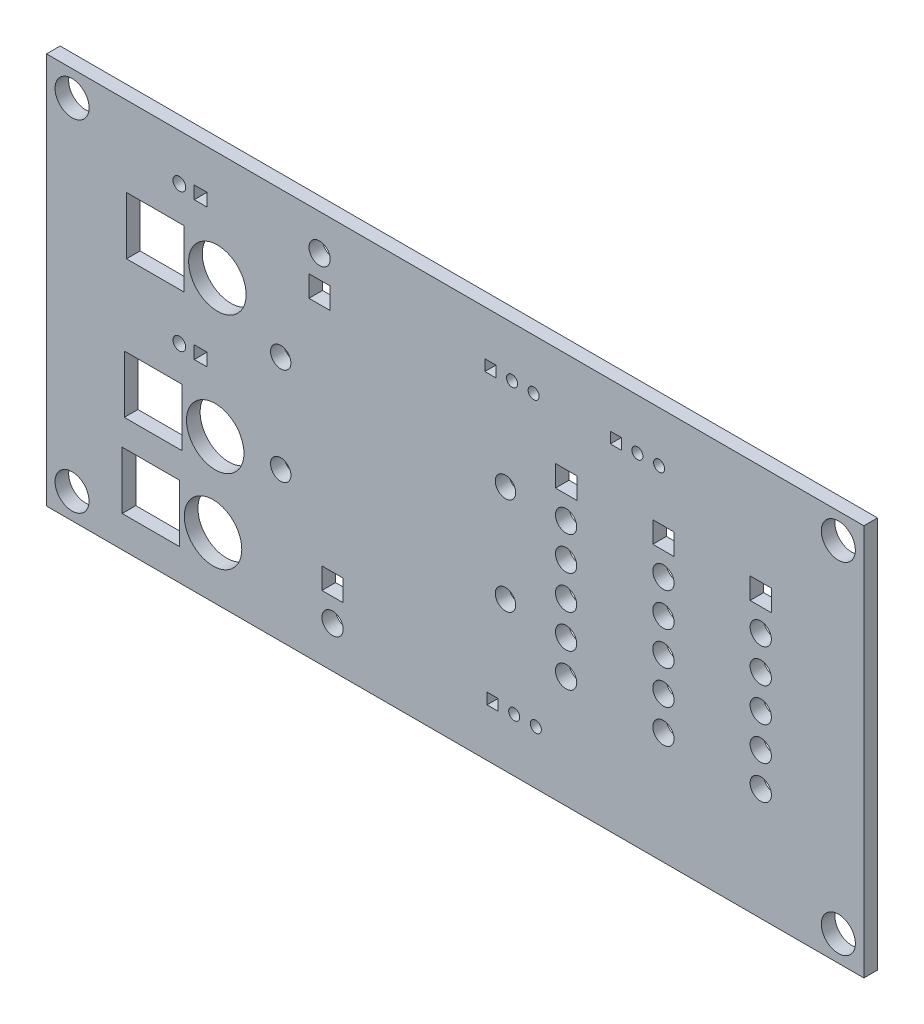
from build123d import *

# Parameters (mm, degrees)
MODEL_W            = 96
MODEL_H            = 46
MODEL_R            = 1.25
MODEL_R_2          = 2
MODEL_R_3          = 0.65
MODEL_R_4          = 1.2
MODEL_R_5          = 0.75
MODEL_R_6          = 3.375
MODEL_W_2          = 2.5
MODEL_H_2          = 2.5
MODEL_W_3          = 1.3
MODEL_H_3          = 1.3
MODEL_W_4          = 1.5
MODEL_H_4          = 1.5
MODEL_W_5          = 6.75
MODEL_H_5          = 6.75
BOSS_EXTRU_1_DEPTH = 1.6


with BuildPart() as part:
    # Model → Boss.-Extru.1 (new body)
    with BuildSketch(Plane.XY):
        with Locations((-43, 20)):
            Rectangle(MODEL_W, MODEL_H)
        with Locations((-58.928, 38.758)):
            Circle(MODEL_R, mode=Mode.SUBTRACT)
        with Locations((-57.404, 1.882)):
            Circle(MODEL_R, mode=Mode.SUBTRACT)
        with Locations((-88, 40)):
            Circle(MODEL_R_2, mode=Mode.SUBTRACT)
        with Locations((-88, 0)):
            Circle(MODEL_R_2, mode=Mode.SUBTRACT)
        with Locations((2, 0)):
            Circle(MODEL_R_2, mode=Mode.SUBTRACT)
        with Locations((2, 40)):
            Circle(MODEL_R_2, mode=Mode.SUBTRACT)
        with Locations((-7.112, 26.012)):
            Circle(MODEL_R, mode=Mode.SUBTRACT)
        with Locations((-7.112, 22.052)):
            Circle(MODEL_R, mode=Mode.SUBTRACT)
        with Locations((-7.112, 18.092)):
            Circle(MODEL_R, mode=Mode.SUBTRACT)
        with Locations((-7.112, 14.132)):
            Circle(MODEL_R, mode=Mode.SUBTRACT)
        with Locations((-7.112, 10.172)):
            Circle(MODEL_R, mode=Mode.SUBTRACT)
        with Locations((-18.542, 26.012)):
            Circle(MODEL_R, mode=Mode.SUBTRACT)
        with Locations((-18.542, 22.052)):
            Circle(MODEL_R, mode=Mode.SUBTRACT)
        with Locations((-18.542, 18.092)):
            Circle(MODEL_R, mode=Mode.SUBTRACT)
        with Locations((-18.542, 14.132)):
            Circle(MODEL_R, mode=Mode.SUBTRACT)
        with Locations((-18.542, 10.172)):
            Circle(MODEL_R, mode=Mode.SUBTRACT)
        with Locations((-29.972, 26.012)):
            Circle(MODEL_R, mode=Mode.SUBTRACT)
        with Locations((-29.972, 22.052)):
            Circle(MODEL_R, mode=Mode.SUBTRACT)
        with Locations((-29.972, 18.092)):
            Circle(MODEL_R, mode=Mode.SUBTRACT)
        with Locations((-29.972, 14.132)):
            Circle(MODEL_R, mode=Mode.SUBTRACT)
        with Locations((-29.972, 10.172)):
            Circle(MODEL_R, mode=Mode.SUBTRACT)
        with Locations((-36.068, 3.302)):
            Circle(MODEL_R_3, mode=Mode.SUBTRACT)
        with Locations((-33.528, 3.302)):
            Circle(MODEL_R_3, mode=Mode.SUBTRACT)
        with Locations((-21.59, 37.084)):
            Circle(MODEL_R_3, mode=Mode.SUBTRACT)
        with Locations((-19.05, 37.084)):
            Circle(MODEL_R_3, mode=Mode.SUBTRACT)
        with Locations((-36.322, 37.084)):
            Circle(MODEL_R_3, mode=Mode.SUBTRACT)
        with Locations((-33.782, 37.084)):
            Circle(MODEL_R_3, mode=Mode.SUBTRACT)
        with Locations((-63.492, 14.478)):
            Circle(MODEL_R_4, mode=Mode.SUBTRACT)
        with Locations((-37.092, 14.478)):
            Circle(MODEL_R_4, mode=Mode.SUBTRACT)
        with Locations((-63.492, 25.908)):
            Circle(MODEL_R_4, mode=Mode.SUBTRACT)
        with Locations((-37.092, 25.908)):
            Circle(MODEL_R_4, mode=Mode.SUBTRACT)
        with Locations((-75.398, 21.336)):
            Circle(MODEL_R_5, mode=Mode.SUBTRACT)
        with Locations((-75.398, 37.592)):
            Circle(MODEL_R_5, mode=Mode.SUBTRACT)
        with Locations((-71.44, 4.064)):
            Circle(MODEL_R_6, mode=Mode.SUBTRACT)
        with Locations((-71.186, 13.97)):
            Circle(MODEL_R_6, mode=Mode.SUBTRACT)
        with Locations((-70.932, 30.226)):
            Circle(MODEL_R_6, mode=Mode.SUBTRACT)
        with Locations((-58.928, 34.798)):
            Rectangle(MODEL_W_2, MODEL_H_2, mode=Mode.SUBTRACT)
        with Locations((-57.404, 5.842)):
            Rectangle(MODEL_W_2, MODEL_H_2, mode=Mode.SUBTRACT)
        with Locations((-7.112, 29.972)):
            Rectangle(MODEL_W_2, MODEL_H_2, mode=Mode.SUBTRACT)
        with Locations((-18.542, 29.972)):
            Rectangle(MODEL_W_2, MODEL_H_2, mode=Mode.SUBTRACT)
        with Locations((-29.972, 29.972)):
            Rectangle(MODEL_W_2, MODEL_H_2, mode=Mode.SUBTRACT)
        with Locations((-38.608, 3.302)):
            Rectangle(MODEL_W_3, MODEL_H_3, mode=Mode.SUBTRACT)
        with Locations((-24.13, 37.084)):
            Rectangle(MODEL_W_3, MODEL_H_3, mode=Mode.SUBTRACT)
        with Locations((-38.862, 37.084)):
            Rectangle(MODEL_W_3, MODEL_H_3, mode=Mode.SUBTRACT)
        with Locations((-72.898, 21.336)):
            Rectangle(MODEL_W_4, MODEL_H_4, mode=Mode.SUBTRACT)
        with Locations((-72.898, 37.592)):
            Rectangle(MODEL_W_4, MODEL_H_4, mode=Mode.SUBTRACT)
        with Locations((-78.74, 4.064)):
            Rectangle(MODEL_W_5, MODEL_H_5, mode=Mode.SUBTRACT)
        with Locations((-78.486, 13.97)):
            Rectangle(MODEL_W_5, MODEL_H_5, mode=Mode.SUBTRACT)
        with Locations((-78.232, 30.226)):
            Rectangle(MODEL_W_5, MODEL_H_5, mode=Mode.SUBTRACT)
    extrude(amount=BOSS_EXTRU_1_DEPTH)


solid = part.part
